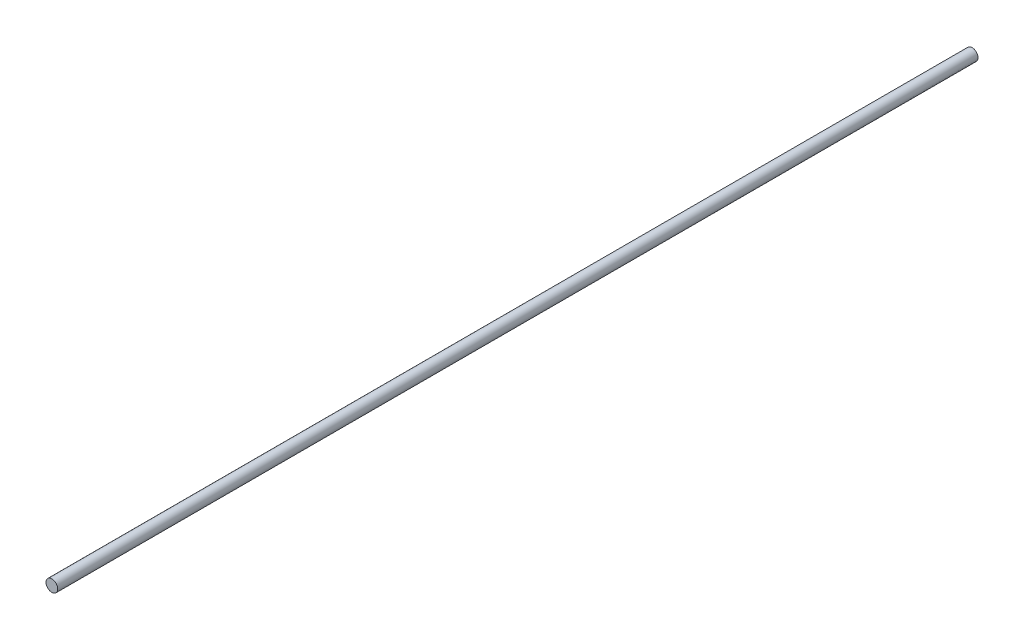
from build123d import *

# Parameters (mm, degrees)
ESQUISSE1_R        = 5
BOSS_EXTRU_1_DEPTH = 785


with BuildPart() as part:
    # Esquisse1 → Boss.-Extru.1 (new body)
    with BuildSketch(Plane.XY):
        Circle(ESQUISSE1_R)
    extrude(amount=BOSS_EXTRU_1_DEPTH)


solid = part.part
